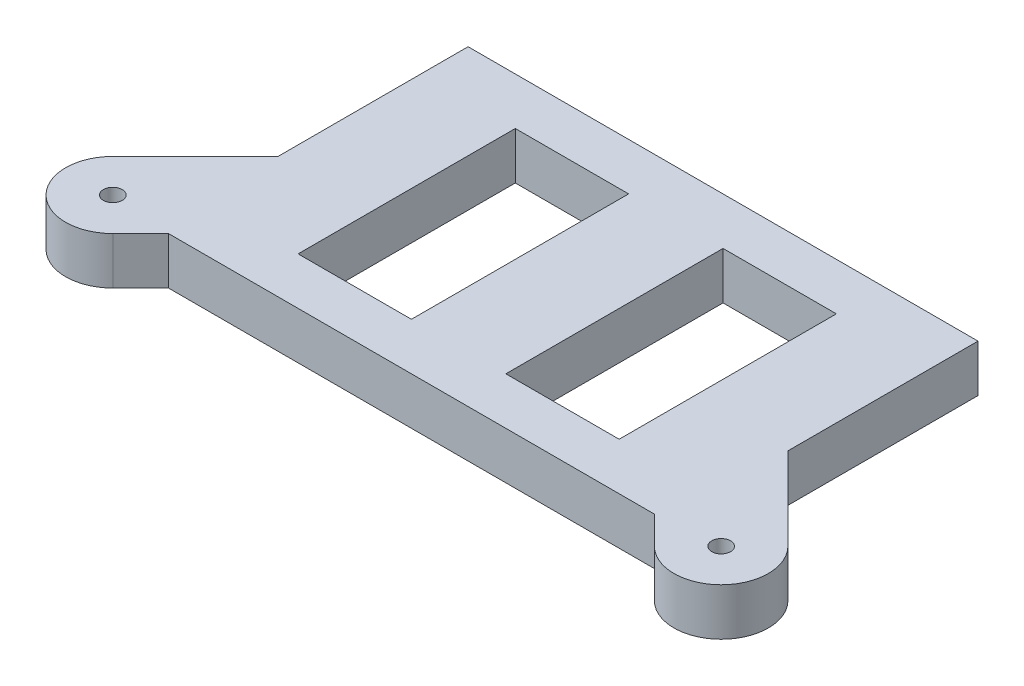
from build123d import *

# Parameters (mm, degrees)
SKETCH1_W           = 54
SKETCH1_H           = 33
SKETCH1_W_2         = 12
SKETCH1_H_2         = 23
BOSS_EXTRUDE1_DEPTH = 5
SKETCH4_R           = 1
BOSS_EXTRUDE2_DEPTH = 5


with BuildPart() as part:
    # Sketch1 → Boss-Extrude1 (new body)
    with BuildSketch(Plane(origin=(0, 0, 0), x_dir=(1, 0, 0), z_dir=(0, 1, 0))):
        with Locations((27, 16.5)):
            Rectangle(SKETCH1_W, SKETCH1_H)
        with Locations((16, 16.5)):
            Rectangle(SKETCH1_W_2, SKETCH1_H_2, mode=Mode.SUBTRACT)
        with Locations((38, 16.5)):
            Rectangle(SKETCH1_W_2, SKETCH1_H_2, mode=Mode.SUBTRACT)
    extrude(amount=BOSS_EXTRUDE1_DEPTH)

    # Sketch4 → Boss-Extrude2 (add)
    # profile 1 of 2: a face of its own
    with BuildSketch(Plane.XZ):
        with BuildLine():
            Line((62.748737342, -4.12233047), (54, -12.871067812))
            Line((54, -12.871067812), (54, 0))
            Line((54, 0), (52.728932188, 0))
            Line((52.728932188, 0), (55.67766953, 2.948737342))
            ThreePointArc((55.67766953, 2.948737342), (62.748737342, 2.948737342), (62.748737342, -4.12233047))
        make_face()
        with Locations(Location((59.213203436, -0.586796564, 0), (0, 0, 270))):
            Circle(SKETCH4_R, mode=Mode.SUBTRACT)
    # profile 2 of 2: a face of its own
    with BuildSketch(Plane.XZ):
        with BuildLine():
            Line((-8.748737342, -4.12233047), (0, -12.871067812))
            Line((0, -12.871067812), (0, 0))
            Line((0, 0), (1.271067812, 0))
            Line((1.271067812, 0), (-1.67766953, 2.948737342))
            ThreePointArc((-1.67766953, 2.948737342), (-8.748737342, 2.948737342), (-8.748737342, -4.12233047))
        make_face()
        with Locations(Location((-5.213203436, -0.586796564, 0), (0, 0, 270))):
            Circle(SKETCH4_R, mode=Mode.SUBTRACT)
    extrude(amount=-BOSS_EXTRUDE2_DEPTH)


solid = part.part
